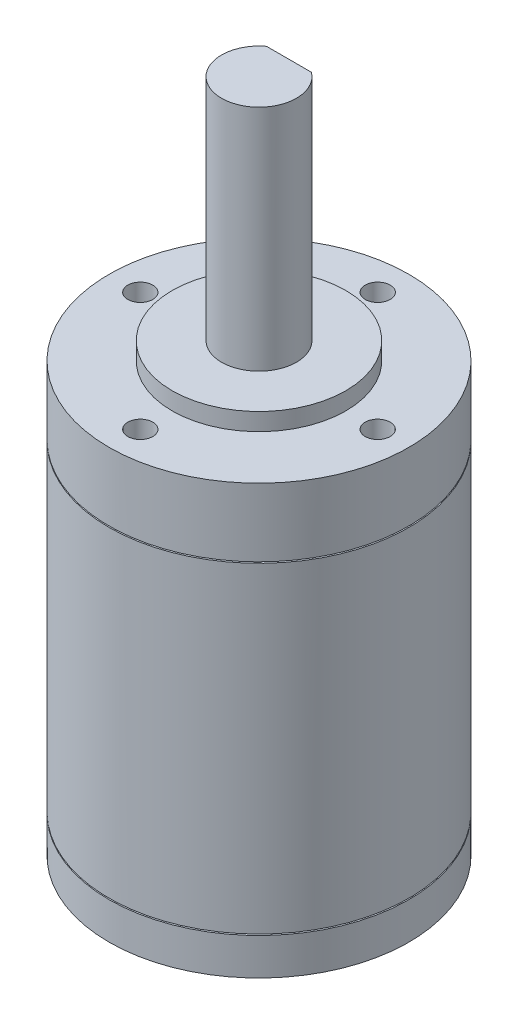
from build123d import *

# Parameters (mm, degrees)
SKETCH_1_R               = 12
EXTRUDE_1_DEPTH          = 34.3
SHELL_6_T                = 2.1
SKETCH_2_R               = 6.95
EXTRUDE_2_DEPTH          = 1.4
SKETCH_3_R               = 3
EXTRUDE_3_DEPTH          = 18.3
CUT_EXTRUDE_1_DEPTH      = 15
SKETCH_5_R               = 3.1
CUT_EXTRUDE_2_DEPTH      = 10
CHAMFER_1_SIZE           = 0.9
SKETCH_7_R               = 1
CUT_EXTRUDE_3_DEPTH      = 10
PATTERN_CIRCULAR_1_COUNT = 4
SKETCH_8_R               = 1.5
CUT_EXTRUDE_4_DEPTH      = 10
PATTERN_CIRCULAR_2_COUNT = 2
SKETCH_10_W              = 1
SKETCH_10_H              = 0.1


with BuildPart() as part:
    # 草图1 → 凸台-拉伸1 (new body)
    with BuildSketch(Plane(origin=(0, 0, 0), x_dir=(1, 0, 0), z_dir=(0, 1, 0))):
        with Locations(Location((0, 0, 0), (0, 0, 270))):
            Circle(SKETCH_1_R)
    extrude(amount=EXTRUDE_1_DEPTH)

    # 抽壳6 (no face opened: a closed hollow body)
    add(offset(amount=-SHELL_6_T, mode=Mode.PRIVATE), mode=Mode.SUBTRACT)

    # 草图2 → 凸台-拉伸2 (add)
    with BuildSketch(Plane(origin=(0, 34.3, 0), x_dir=(1, 0, 0), z_dir=(0, 1, 0))):
        with Locations(Location((0, 0, 0), (0, 0, 270))):
            Circle(SKETCH_2_R)
    extrude(amount=EXTRUDE_2_DEPTH)

    # 草图3 → 凸台-拉伸3 (add)
    with BuildSketch(Plane(origin=(0, 35.7, 0), x_dir=(1, 0, 0), z_dir=(0, 1, 0))):
        with Locations(Location((0, 0, 0), (0, 0, 270))):
            Circle(SKETCH_3_R)
    extrude(amount=EXTRUDE_3_DEPTH)

    # 草图4 → 切除-拉伸1 (cut)
    with BuildSketch(Plane(origin=(0, 54, 0), x_dir=(1, 0, 0), z_dir=(0, 1, 0))):
        Polygon((-4.180388969, 2.4), (5.154958177, 2.4), (-0.718103627, 5.682759436), align=None)
    extrude(amount=-CUT_EXTRUDE_1_DEPTH, mode=Mode.SUBTRACT)

    # 草图5 → 切除-拉伸2 (cut)
    with BuildSketch(Plane.XZ):
        with Locations(Location((0, 0, 0), (0, 0, 270))):
            Circle(SKETCH_5_R)
    extrude(amount=-CUT_EXTRUDE_2_DEPTH, mode=Mode.SUBTRACT)

    # 倒角1
    chamfer_1_edges = [part.edges().sort_by_distance(p)[0] for p in [
        (0, 0, 3.1),
    ]]
    chamfer(chamfer_1_edges, length=CHAMFER_1_SIZE)

    # 草图7 → 切除-拉伸3 (cut)
    with BuildSketch(Plane(origin=(0, 34.3, 0), x_dir=(1, 0, 0), z_dir=(0, 1, 0))):
        with Locations(Location((0, 9.5, 0), (0, 0, 270))):
            Circle(SKETCH_7_R)
    cut_extrude_3 = extrude(amount=-CUT_EXTRUDE_3_DEPTH, mode=Mode.SUBTRACT)

    # 阵列(圆周)1: 切除-拉伸3 ×4 about axis
    pattern_circular_1_axis = Axis((0, 0, 0), (0, 1, 0))
    for i in range(1, PATTERN_CIRCULAR_1_COUNT):
        add(cut_extrude_3.rotate(pattern_circular_1_axis, i * 360 / PATTERN_CIRCULAR_1_COUNT), mode=Mode.SUBTRACT)

    # 草图8 → 切除-拉伸4 (cut)
    with BuildSketch(Plane.XZ):
        with Locations(Location((0, 8, 0), (0, 0, 270))):
            Circle(SKETCH_8_R)
    cut_extrude_4 = extrude(amount=-CUT_EXTRUDE_4_DEPTH, mode=Mode.SUBTRACT)

    # 阵列(圆周)2: 切除-拉伸4 ×2 about axis
    pattern_circular_2_axis = Axis((0, 0, 0), (0, 1, 0))
    for i in range(1, PATTERN_CIRCULAR_2_COUNT):
        add(cut_extrude_4.rotate(pattern_circular_2_axis, i * 360 / PATTERN_CIRCULAR_2_COUNT), mode=Mode.SUBTRACT)

    # 草图10 → 切除-旋转1 (revolve, cut)
    with BuildSketch(Plane.XY, mode=Mode.PRIVATE) as cut_revolve_1_sk:
        with Locations((11.890198227, 28.8)):
            Rectangle(SKETCH_10_W, SKETCH_10_H)
        with Locations((12, 3)):
            Rectangle(SKETCH_10_W, SKETCH_10_H)
    revolve(cut_revolve_1_sk.sketch.rotate(Axis((0, 62.182119541, 0), (0, -1, 0)), 233.130102354), axis=Axis((0, 62.182119541, 0), (0, -1, 0)), mode=Mode.SUBTRACT)


solid = part.part
